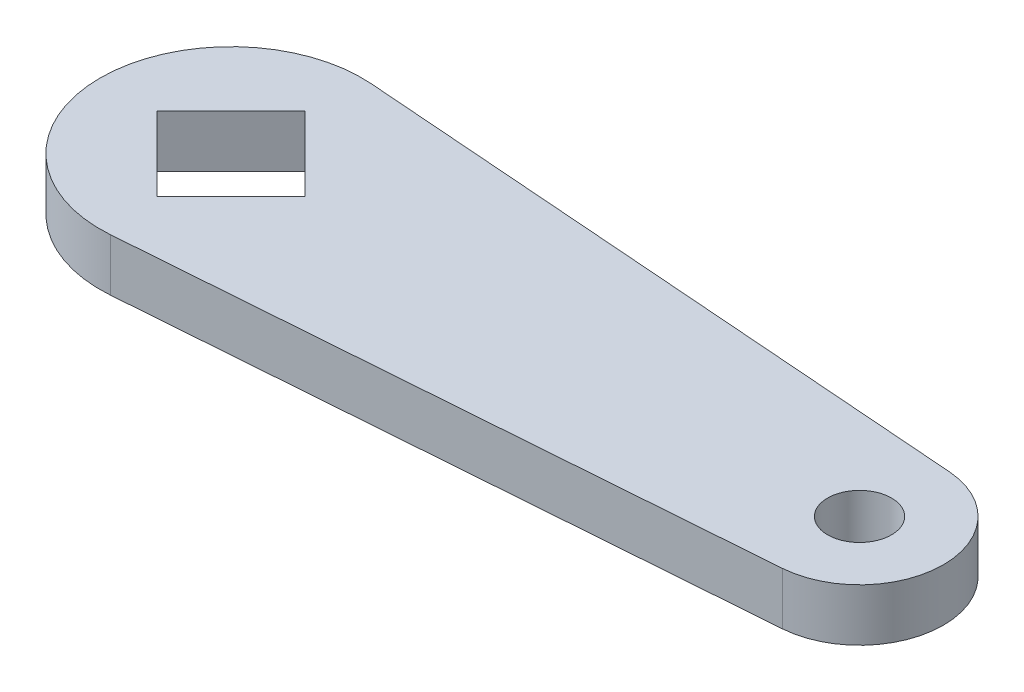
from build123d import *

# Parameters (mm, degrees)
SKETCH_1_R      = 12.5
SKETCH_1_R_2    = 8
SKETCH_1_R_3    = 3.05
EXTRUDE_1_DEPTH = 5


with BuildPart() as part:
    # 草图1 → 凸台-拉伸1 (new body)
    # profile 1 of 3: a face of its own
    with BuildSketch(Plane(origin=(0, 0, 0), x_dir=(1, 0, 0), z_dir=(0, 1, 0))):
        with BuildLine():
            ThreePointArc((12.5, 0), (9.164298937, -8.500919068), (0.9375, -12.464794172))
            Line((0.9375, -12.464794172), (60.6, -7.97746827))
            ThreePointArc((60.6, -7.97746827), (52, 0), (60.6, 7.97746827))
            Line((60.6, 7.97746827), (0.9375, 12.464794172))
            ThreePointArc((0.9375, 12.464794172), (9.164298937, 8.500919068), (12.5, 0))
        make_face()
    # profile 2 of 3: a face of its own
    with BuildSketch(Plane(origin=(0, 0, 0), x_dir=(1, 0, 0), z_dir=(0, 1, 0))):
        Circle(SKETCH_1_R)
        Polygon((0, -7.071067812), (7.071067812, 0), (0, 7.071067812), (-7.071067812, 0), align=None, mode=Mode.SUBTRACT)
    # profile 3 of 3: a face of its own
    with BuildSketch(Plane(origin=(0, 0, 0), x_dir=(1, 0, 0), z_dir=(0, 1, 0))):
        with Locations((60, 0)):
            Circle(SKETCH_1_R_2)
        with Locations(Location((60, 0, 0), (0, 0, 270))):
            Circle(SKETCH_1_R_3, mode=Mode.SUBTRACT)
    extrude(amount=EXTRUDE_1_DEPTH)


solid = part.part
